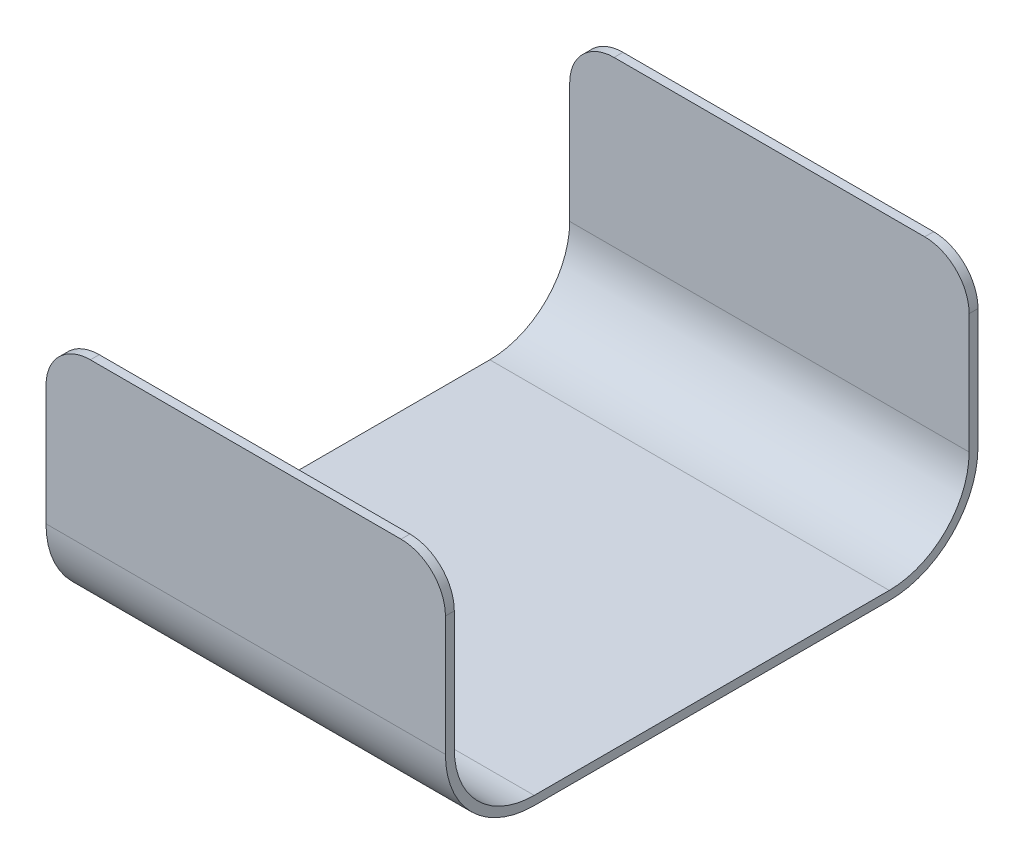
from build123d import *

# Parameters (mm, degrees)
SKETCH1_W           = 90
SKETCH1_H           = 57
BOSS_EXTRUDE1_DEPTH = 60
FILLET1_R           = 20
SHELL1_T            = -2
FILLET2_R           = 10


with BuildPart() as part:
    # Sketch1 → Boss-Extrude1 (new, symmetric)
    with BuildSketch(Plane.XY):
        Rectangle(SKETCH1_W, SKETCH1_H)
    extrude(amount=BOSS_EXTRUDE1_DEPTH, both=True)

    # Fillet1
    fillet1_edges = [part.edges().sort_by_distance(p)[0] for p in [
        (0, -28.5, -60),
        (0, -28.5, 60),
    ]]
    fillet(fillet1_edges, radius=FILLET1_R)

    # Shell1
    shell1_openings = [part.faces().sort_by_distance(p)[0] for p in [
        (-45, 0.618740562, 0),
        (45, 0.618740562, 0),
        (0, 28.5, 0),
    ]]
    offset(amount=SHELL1_T, openings=shell1_openings, kind=Kind.INTERSECTION)

    # Fillet2
    fillet2_edges = [part.edges().sort_by_distance(p)[0] for p in [
        (45, 28.5, -59),
        (-45, 28.5, -59),
        (45, 28.5, 59),
        (-45, 28.5, 59),
    ]]
    fillet(fillet2_edges, radius=FILLET2_R)


solid = part.part
